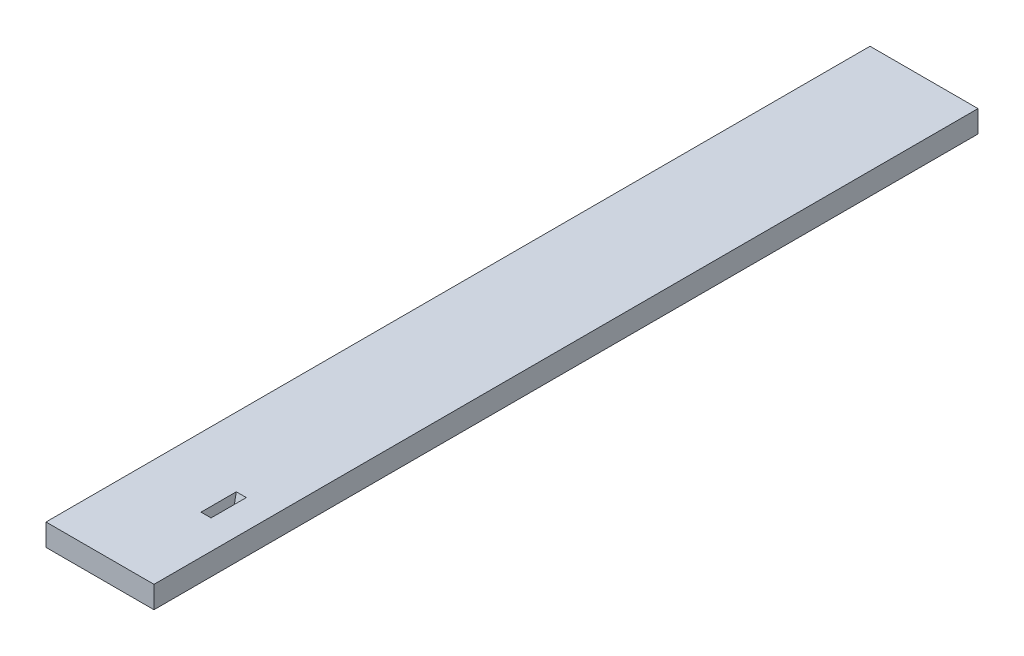
from build123d import *

# Parameters (mm, degrees)
SKETCH_4_W          = 196
SKETCH_4_H          = 1495.709506603
EXTRUDE_2_DEPTH     = 40
SKETCH_10_W         = 18.18
SKETCH_10_H         = 64.044231727
CUT_EXTRUDE_1_DEPTH = 46.474040195


with BuildPart() as part:
    # 草圖4 → 填料-伸長2 (new body)
    with BuildSketch(Plane(origin=(0, 40, 0), x_dir=(-1, 0, 0), z_dir=(0, 1, 0))):
        with Locations((0, 2.145246698)):
            Rectangle(SKETCH_4_W, SKETCH_4_H)
    extrude(amount=-EXTRUDE_2_DEPTH)

    # 草圖10 → 除料-伸長1 (cut, along a direction that is not the sketch's normal)
    with BuildSketch(Plane(origin=(0, 0, 0), x_dir=(1, 0, 0), z_dir=(0, 1, 0))):
        with Locations((42.342503168, -576.7595183)):
            Rectangle(SKETCH_10_W, SKETCH_10_H)
    extrude(amount=CUT_EXTRUDE_1_DEPTH, dir=(-0.13916051909627253, 0.9277367939751496, -0.34632180270604807), mode=Mode.SUBTRACT)


solid = part.part
